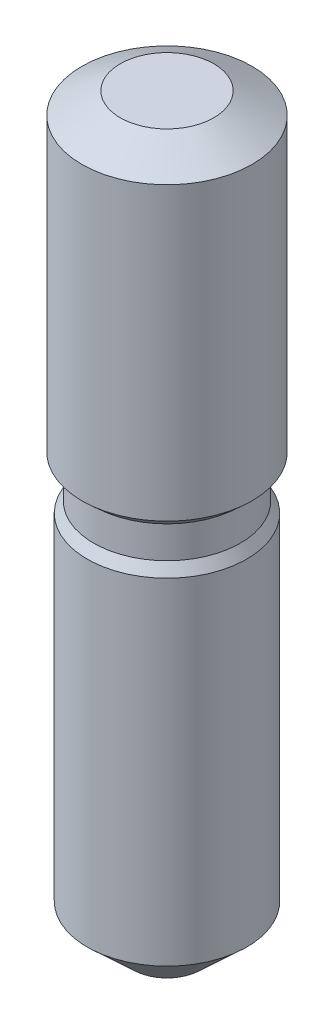
from build123d import *


with BuildPart() as part:
    # Sketch1 → Motor_reductora_husillo (revolve)
    with BuildSketch(Plane.XY, mode=Mode.PRIVATE) as motor_reductora_husillo_sk:
        Polygon((0, 0), (4.4, 0), (8, -2), (8, -29.4), (6.9, -30.4), (6.9, -33.4), (7.5, -34.4), (7.5, -66), (3.2, -70), (0, -70), align=None)
    revolve(motor_reductora_husillo_sk.sketch.rotate(Axis((0, -74, 0), (0, 1, 0)), 90), axis=Axis((0, -74, 0), (0, 1, 0)))


solid = part.part
